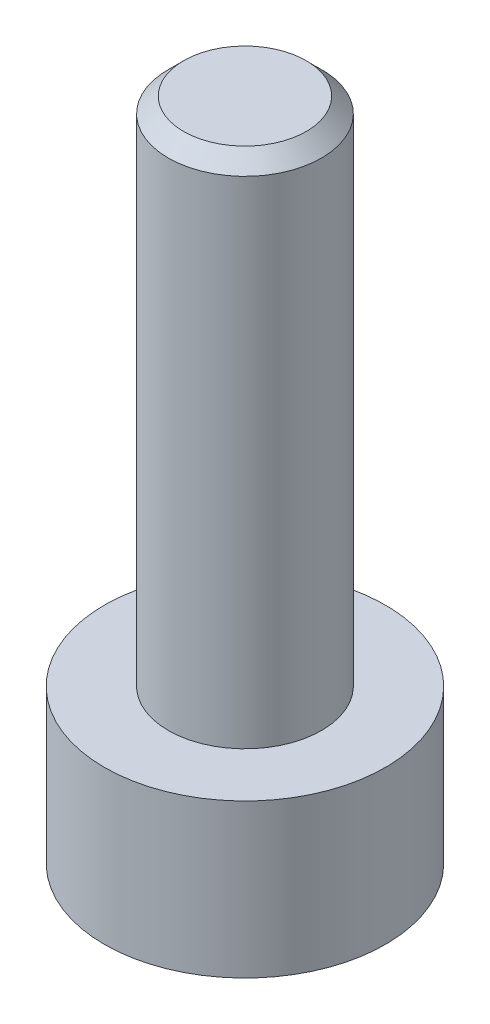
from build123d import *

# Parameters (mm, degrees)
SKETCH_1_R          = 2.75
EXTRUDE_1_DEPTH     = 3
CUT_EXTRUDE_1_DEPTH = 1.5
SKETCH_2_R          = 1.5
EXTRUDE_2_DEPTH     = 10
CHAMFER_1_SIZE      = 0.3


with BuildPart() as part:
    # 草图1 → 凸台-拉伸1 (new body)
    with BuildSketch(Plane(origin=(0, 0, 0), x_dir=(1, 0, 0), z_dir=(0, 1, 0))):
        with Locations(Location((0, 0, 0), (0, 0, 270))):
            Circle(SKETCH_1_R)
    extrude(amount=EXTRUDE_1_DEPTH)

    # 草图3 → 切除-拉伸1 (cut)
    with BuildSketch(Plane.XZ):
        Polygon((0, 1.25), (-1.082531755, 0.625), (-1.082531755, -0.625), (0, -1.25), (1.082531755, -0.625), (1.082531755, 0.625), align=None)
    extrude(amount=-CUT_EXTRUDE_1_DEPTH, mode=Mode.SUBTRACT)

    # 草图2 → 凸台-拉伸2 (add)
    with BuildSketch(Plane(origin=(0, 3, 0), x_dir=(1, 0, 0), z_dir=(0, 1, 0))):
        with Locations(Location((0, 0, 0), (0, 0, 270))):
            Circle(SKETCH_2_R)
    extrude(amount=EXTRUDE_2_DEPTH)

    # 倒角1
    chamfer_1_edges = [part.edges().sort_by_distance(p)[0] for p in [
        (0, 13, -1.5),
    ]]
    chamfer(chamfer_1_edges, length=CHAMFER_1_SIZE)


solid = part.part
